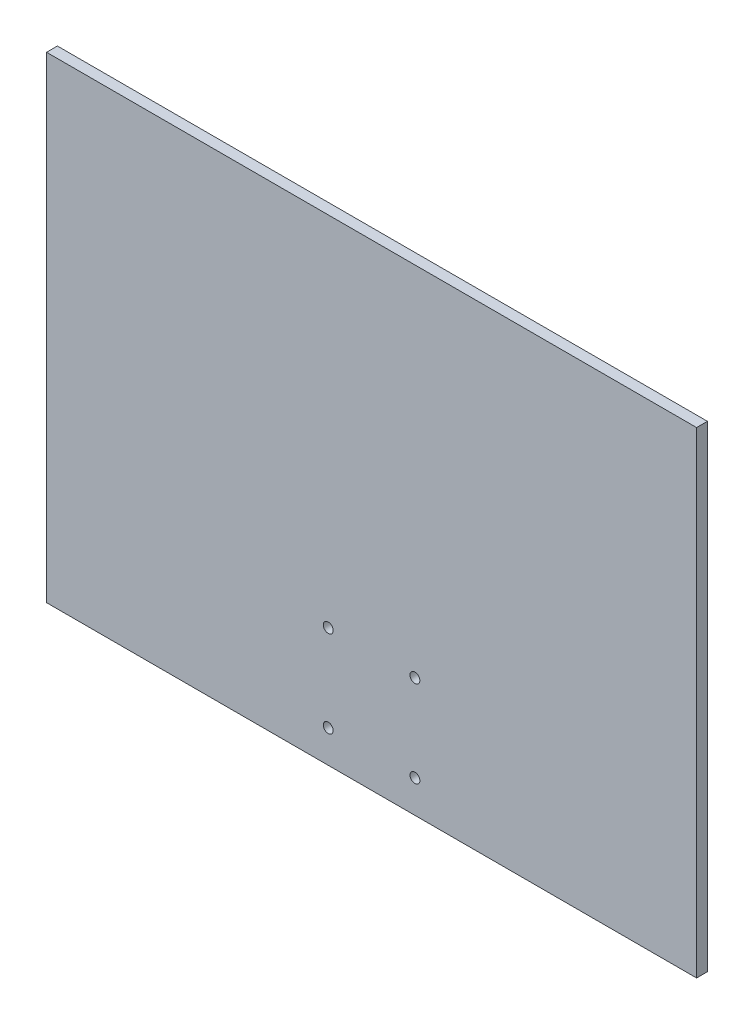
from build123d import *

# Parameters (mm, degrees)
SKETCH1_W            = 381
SKETCH1_H            = 279.4
BOSS_EXTRUDE1_DEPTH  = 6.35
M5_CLEARANCE_HOLE1_D = 5.8


with BuildPart() as part:
    # Sketch1 → Boss-Extrude1 (new body)
    with BuildSketch(Plane.XY):
        Rectangle(SKETCH1_W, SKETCH1_H)
    extrude(amount=BOSS_EXTRUDE1_DEPTH)

    # M5 Clearance Hole1 (through all)
    with Locations(Plane.XY.offset(6.35)):
        with Locations((-25.4, -120.65), (-25.4, -69.85), (25.4, -120.65), (25.4, -69.85)):
            Hole(M5_CLEARANCE_HOLE1_D / 2)


solid = part.part
